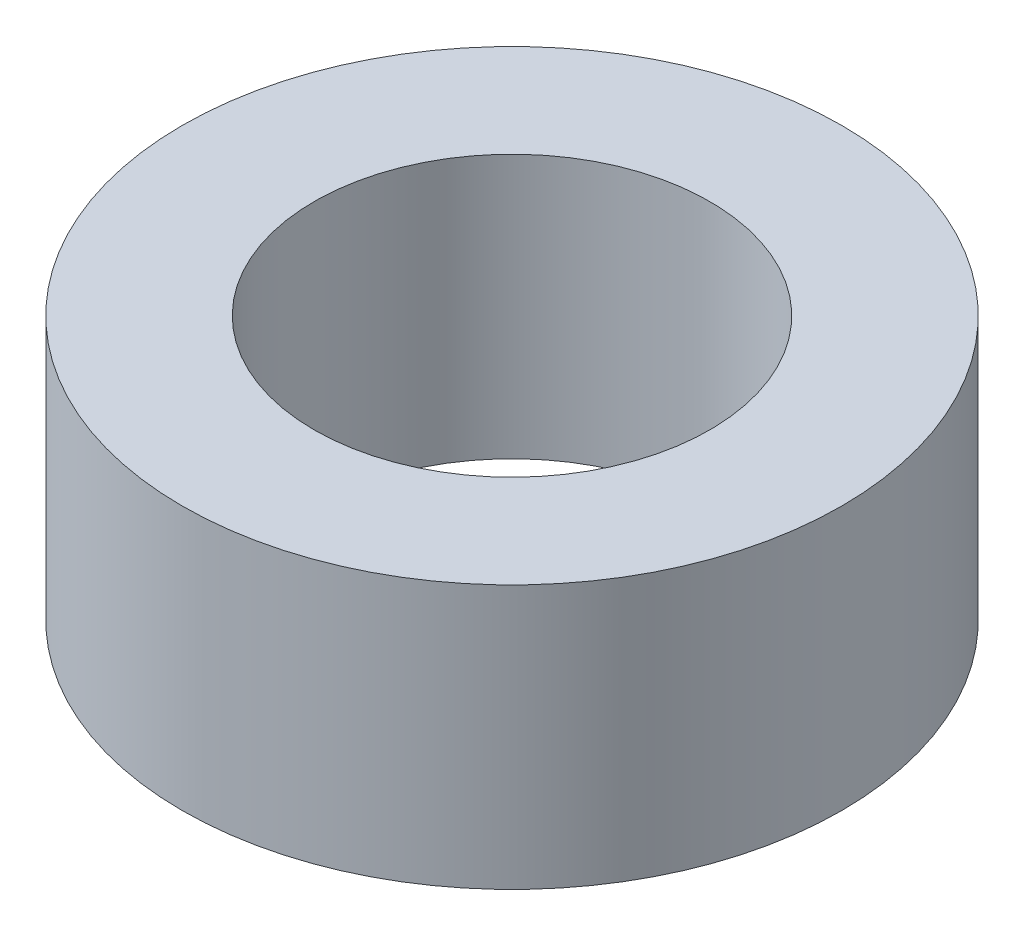
from build123d import *

# Parameters (mm, degrees)
SKETCH1_R           = 15.875
SKETCH1_R_2         = 9.525
BOSS_EXTRUDE1_DEPTH = 12.7


with BuildPart() as part:
    # Sketch1 → Boss-Extrude1 (new body)
    with BuildSketch(Plane(origin=(0, 0, 0), x_dir=(1, 0, 0), z_dir=(0, 1, 0))):
        with Locations(Location((0, 0, 0), (0, 0, 270))):
            Circle(SKETCH1_R)
        with Locations(Location((0, 0, 0), (0, 0, 270))):
            Circle(SKETCH1_R_2, mode=Mode.SUBTRACT)
    extrude(amount=BOSS_EXTRUDE1_DEPTH)


solid = part.part
